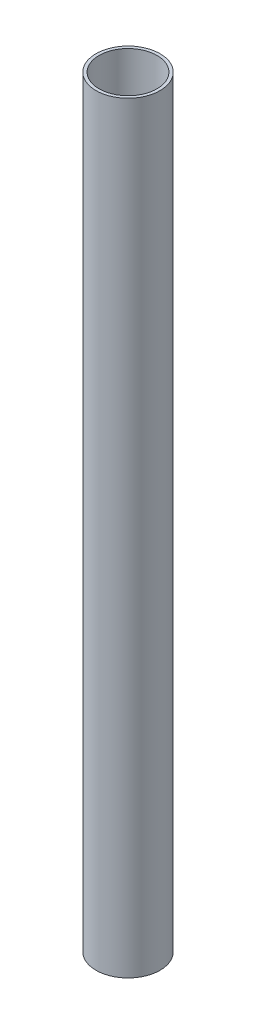
from build123d import *

# Parameters (mm, degrees)
SKETCH1_R           = 10.5
SKETCH1_R_2         = 9.5
EXTRUDE_THIN1_DEPTH = 250


with BuildPart() as part:
    # Sketch1 → Extrude-Thin1 (new body)
    with BuildSketch(Plane(origin=(0, 0, 0), x_dir=(1, 0, 0), z_dir=(0, 1, 0))):
        Circle(SKETCH1_R)
        Circle(SKETCH1_R_2, mode=Mode.SUBTRACT)
    extrude(amount=EXTRUDE_THIN1_DEPTH)


solid = part.part
